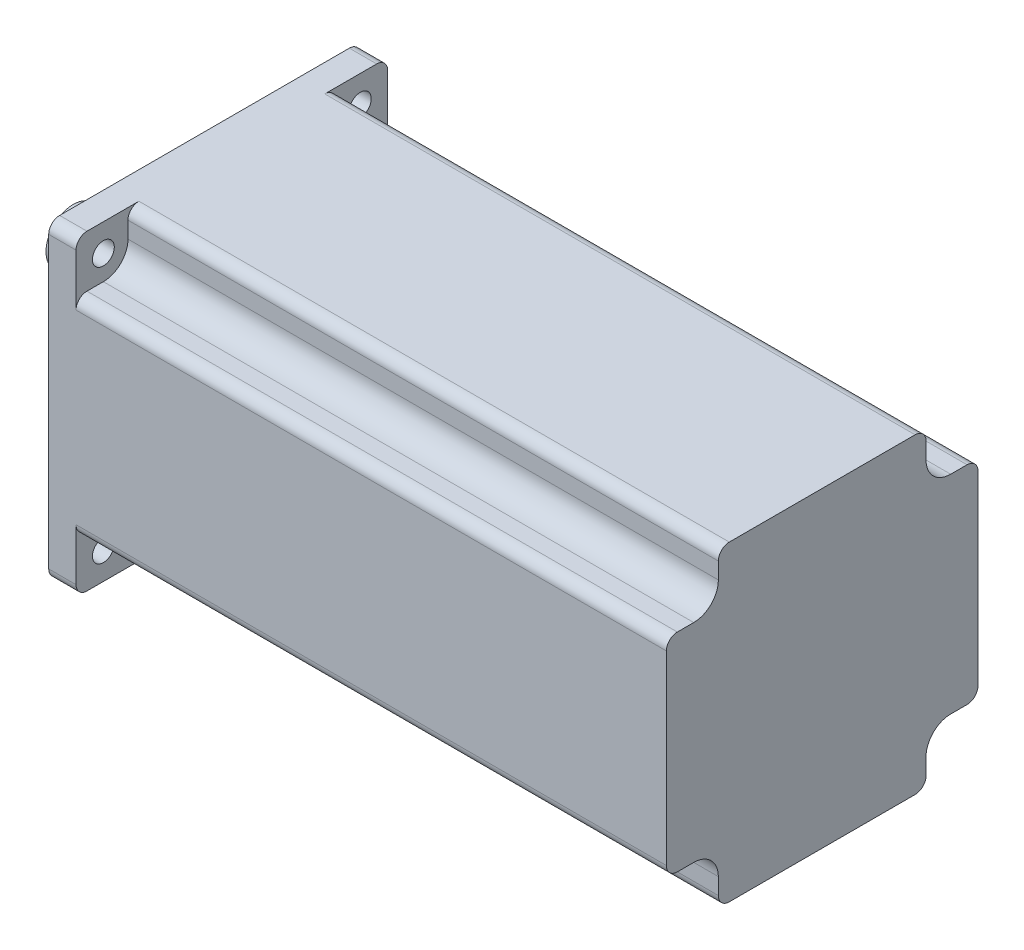
from build123d import *

# Parameters (mm, degrees)
SKETCH2_W            = 113
SKETCH2_H            = 57
BOSS_EXTRUDE1_DEPTH  = 57
SKETCH11_R           = 5
BOSS_EXTRUDE12_DEPTH = 24
SKETCH11_6_R         = 19
SKETCH11_6_R_2       = 5
BOSS_EXTRUDE13_DEPTH = 1.6
SKETCH13_R           = 2
CUT_EXTRUDE1_DEPTH   = 113
CUT_EXTRUDE4_START   = -20
CUT_EXTRUDE4_DEPTH   = 20
CUT_EXTRUDE5_START   = -108
SKETCH22_R           = 2
CUT_EXTRUDE5_DEPTH   = 108
FILLET1_R            = 2
FILLET2_R            = 2


with BuildPart() as part:
    # Sketch2 → Boss-Extrude1 (new body)
    with BuildSketch(Plane(origin=(0, 0, 0), x_dir=(1, 0, 0), z_dir=(0, 1, 0))):
        with Locations((56.5, 28.5)):
            Rectangle(SKETCH2_W, SKETCH2_H)
    extrude(amount=BOSS_EXTRUDE1_DEPTH)

    # Sketch11 → Boss-Extrude12 (add)
    with BuildSketch(Plane.ZY):
        with Locations((-28.5, 28.5)):
            Circle(SKETCH11_R)
    extrude(amount=BOSS_EXTRUDE12_DEPTH)

    # Sketch11<6> → Boss-Extrude13 (add)
    with BuildSketch(Plane.ZY):
        with Locations((-28.5, 28.5)):
            Circle(SKETCH11_6_R)
        with Locations((-28.5, 28.5)):
            Circle(SKETCH11_6_R_2, mode=Mode.SUBTRACT)
    extrude(amount=BOSS_EXTRUDE13_DEPTH)

    # Sketch13 → Cut-Extrude1 (cut)
    with BuildSketch(Plane.ZY):
        with Locations((-5, 5)):
            Circle(SKETCH13_R)
        with Locations((-52, 5)):
            Circle(SKETCH13_R)
        with Locations((-52, 52)):
            Circle(SKETCH13_R)
        with Locations((-5, 52)):
            Circle(SKETCH13_R)
    extrude(amount=-CUT_EXTRUDE1_DEPTH, mode=Mode.SUBTRACT)

    # Sketch14 → Cut-Extrude4 (cut)
    with BuildSketch(Plane.ZY.offset(24).offset(CUT_EXTRUDE4_START)):
        with BuildLine():
            Line((-28.5, 24.207845288), (-31.06464577, 24.207845288))
            ThreePointArc((-31.06464577, 24.207845288), (-28.5, 23.5), (-25.93535423, 24.207845288))
            Line((-25.93535423, 24.207845288), (-28.5, 24.207845288))
        make_face()
    extrude(amount=CUT_EXTRUDE4_DEPTH, mode=Mode.SUBTRACT)

    # Sketch22 → Cut-Extrude5 (cut)
    # profile 1 of 4: a face of its own
    with BuildSketch(Plane(origin=(113, 0, 0), x_dir=(0, 0, -1), z_dir=(1, 0, 0)).offset(CUT_EXTRUDE5_START)):
        with BuildLine():
            ThreePointArc((47.5, 52), (48.818019485, 48.818019485), (52, 47.5))
            Line((52, 47.5), (57, 47.5))
            Line((57, 47.5), (57, 57))
            Line((57, 57), (47.5, 57))
            Line((47.5, 57), (47.5, 52))
        make_face()
        with Locations((52, 52)):
            Circle(SKETCH22_R, mode=Mode.SUBTRACT)
    # profile 2 of 4: a face of its own
    with BuildSketch(Plane(origin=(113, 0, 0), x_dir=(0, 0, -1), z_dir=(1, 0, 0)).offset(CUT_EXTRUDE5_START)):
        with BuildLine():
            Line((57, 0), (57, 9.5))
            Line((57, 9.5), (52, 9.5))
            ThreePointArc((52, 9.5), (48.818019485, 8.181980515), (47.5, 5))
            Line((47.5, 5), (47.5, 0))
            Line((47.5, 0), (57, 0))
        make_face()
        with Locations((52, 5)):
            Circle(SKETCH22_R, mode=Mode.SUBTRACT)
    # profile 3 of 4: a face of its own
    with BuildSketch(Plane(origin=(113, 0, 0), x_dir=(0, 0, -1), z_dir=(1, 0, 0)).offset(CUT_EXTRUDE5_START)):
        with BuildLine():
            Line((9.5, 52), (9.5, 57))
            Line((9.5, 57), (0, 57))
            Line((0, 57), (0, 47.5))
            Line((0, 47.5), (5, 47.5))
            ThreePointArc((5, 47.5), (8.181980515, 48.818019485), (9.5, 52))
        make_face()
        with Locations((5, 52)):
            Circle(SKETCH22_R, mode=Mode.SUBTRACT)
    # profile 4 of 4: a face of its own
    with BuildSketch(Plane(origin=(113, 0, 0), x_dir=(0, 0, -1), z_dir=(1, 0, 0)).offset(CUT_EXTRUDE5_START)):
        with BuildLine():
            Line((0, 0), (9.5, 0))
            Line((9.5, 0), (9.5, 5))
            ThreePointArc((9.5, 5), (8.181980515, 8.181980515), (5, 9.5))
            Line((5, 9.5), (0, 9.5))
            Line((0, 9.5), (0, 0))
        make_face()
        with Locations((5, 5)):
            Circle(SKETCH22_R, mode=Mode.SUBTRACT)
    extrude(amount=CUT_EXTRUDE5_DEPTH, mode=Mode.SUBTRACT)

    # Fillet1
    fillet1_edges = [part.edges().sort_by_distance(p)[0] for p in [
        (59, 57, -9.5),
        (59, 57, -47.5),
        (59, 47.5, -57),
        (59, 9.5, -57),
        (59, 0, -47.5),
        (59, 0, -9.5),
        (59, 9.5, 0),
        (59, 47.5, 0),
    ]]
    fillet(fillet1_edges, radius=FILLET1_R)

    # Fillet2
    fillet2_edges = [part.edges().sort_by_distance(p)[0] for p in [
        (2.5, 0, 0),
        (2.5, 0, -57),
        (2.5, 57, -57),
        (2.5, 57, 0),
    ]]
    fillet(fillet2_edges, radius=FILLET2_R)


solid = part.part
